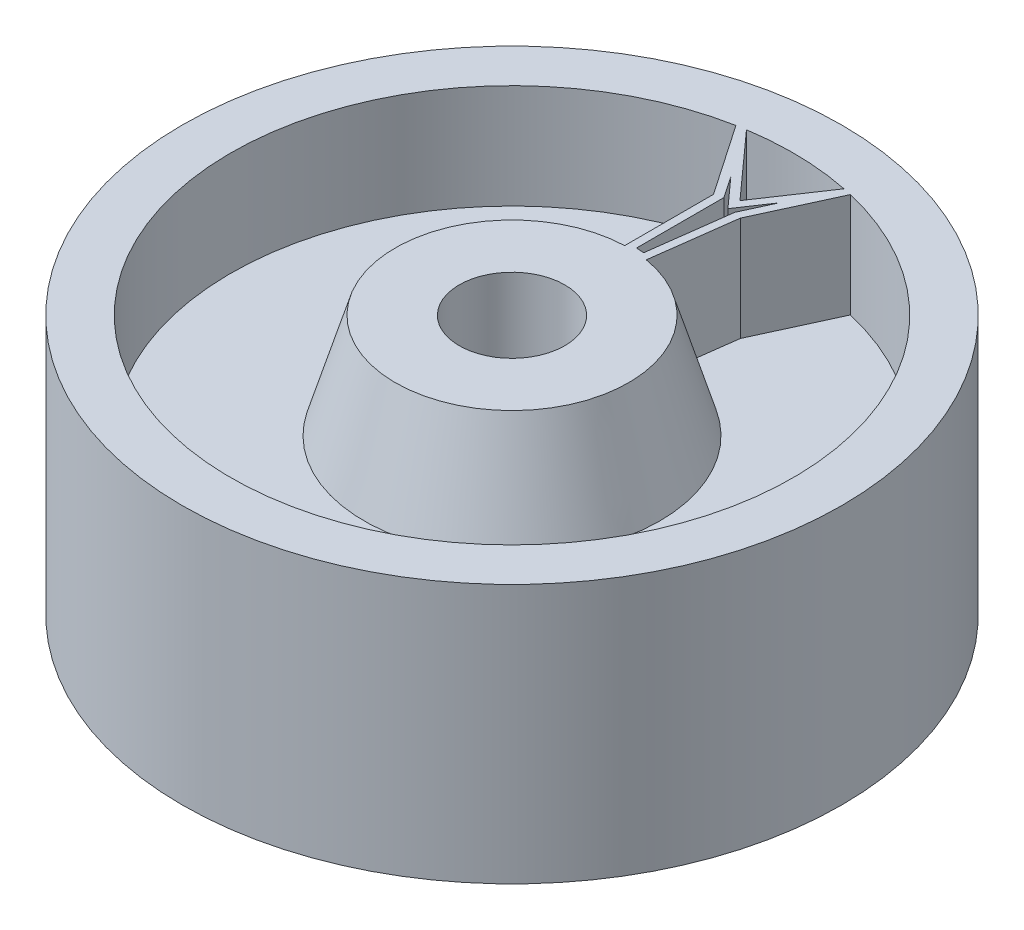
from build123d import *

# Parameters (mm, degrees)
RIB3_REACH = 849.461


with BuildPart() as part:
    # Sketch2 → Revolve2 (revolve)
    with BuildSketch(Plane.XY, mode=Mode.PRIVATE) as revolve2_sk:
        Polygon((-83.825932003, -205.951906896), (-83.825932003, 205.951906896), (-185.425932003, 205.951906896), (-234.75772391, 40.338034064), (-446.766972465, 40.338034064), (-446.766972465, 205.951906896), (-523.701076512, 205.951906896), (-523.701076512, -205.951906896), (-446.766972465, -205.951906896), (-446.766972465, -40.338034064), (-234.75772391, -40.338034064), (-185.425932003, -205.951906896), align=None)
    revolve(revolve2_sk.sketch.rotate(Axis((0, 0, 0), (0, 1, 0)), 270), axis=Axis((0, 0, 0), (0, 1, 0)))

    # Sketch15 walls → Rib3 (add, up to next)
    with BuildSketch(Plane(origin=(0, 205.951906896, 0), x_dir=(1, 0, 0), z_dir=(0, 1, 0)), mode=Mode.PRIVATE) as rib3_sk1:
        Polygon((-6.35, 179.47656005), (-6.35, 326.47470397), (-135.682333379, 515.555894782), (23.333889095, 338.748721611), (135.129805155, 505.477172887), (47.662469422, 314.977908793), (29.606309095, 177.131658856), align=None)
        Polygon((6.35, 191.375303956), (6.35, 330.402645947), (-17.181459102, 364.805151432), (24.798310455, 318.128628306), (57.585986403, 367.02700156), (35.319488971, 318.531739424), (18.559266197, 190.579073097), align=None, mode=Mode.SUBTRACT)
    rib3_tool1 = extrude(rib3_sk1.sketch, amount=-RIB3_REACH, mode=Mode.PRIVATE) - part.part
    add(rib3_tool1.solids().sort_by_distance((60.211997777, 205.951906896, -382.345381091))[0])


solid = part.part
